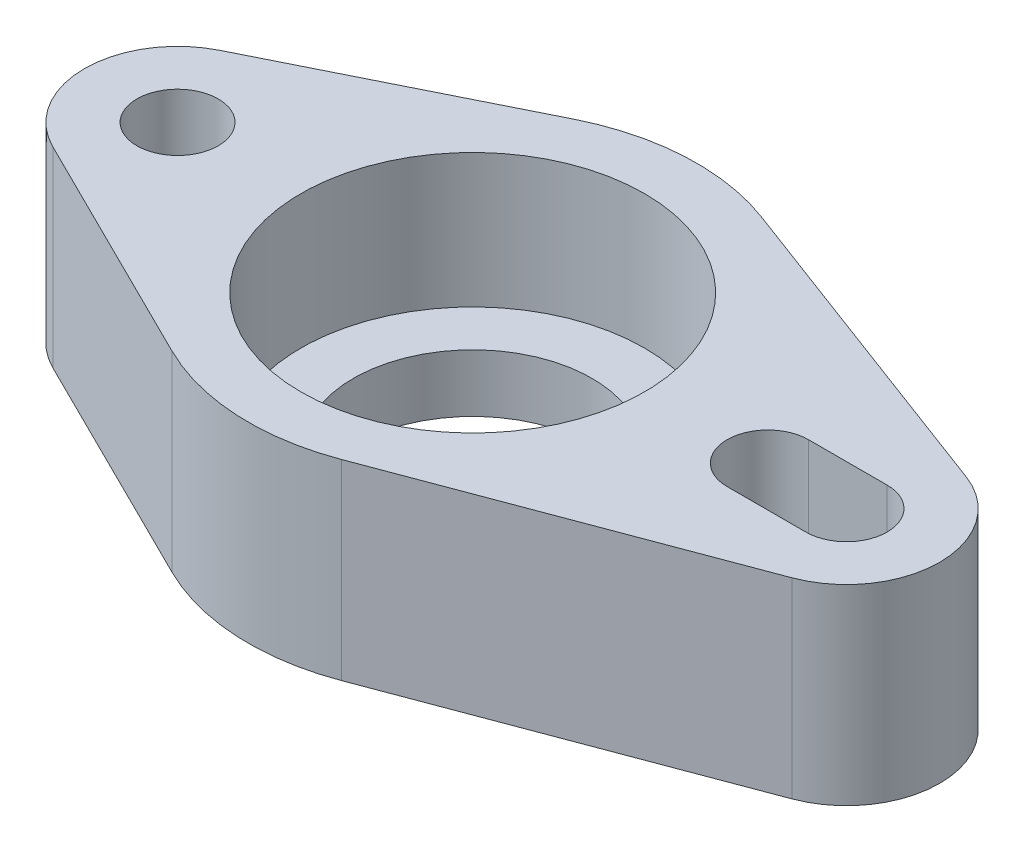
from build123d import *

# Parameters (mm, degrees)
SKETCH1_R     = 6.55
SKETCH1_R_2   = 1.55
BODY_DEPTH    = 7.3
SKETCH1_4_R   = 6.55
SKETCH1_4_R_2 = 4.55
FLOOR_2_DEPTH = 2.2


with BuildPart() as part:
    # Sketch1 → Body (new body)
    with BuildSketch(Plane(origin=(0, 0, 0), x_dir=(1, 0, 0), z_dir=(0, 1, 0))):
        with BuildLine():
            ThreePointArc((15.495614035, -3.324296268), (17.8, 0), (15.495614035, 3.324296268))
            Line((15.495614035, 3.324296268), (3, 8.006403687))
            ThreePointArc((3, 8.006403687), (-0.436058681, 8.538873042), (-3.8, 7.659144861))
            Line((-3.8, 7.659144861), (-12.827777778, 3.180112778))
            ThreePointArc((-12.827777778, 3.180112778), (-14.8, 0), (-12.827777778, -3.180112778))
            Line((-12.827777778, -3.180112778), (-3.8, -7.659144861))
            ThreePointArc((-3.8, -7.659144861), (-0.436058681, -8.538873042), (3, -8.006403687))
            Line((3, -8.006403687), (15.495614035, -3.324296268))
        make_face()
        with BuildLine():
            Line((11.25, 1.55), (14.25, 1.55))
            ThreePointArc((14.25, 1.55), (15.8, 0), (14.25, -1.55))
            Line((14.25, -1.55), (11.25, -1.55))
            ThreePointArc((11.25, -1.55), (9.7, 0), (11.25, 1.55))
        make_face(mode=Mode.SUBTRACT)
        Circle(SKETCH1_R, mode=Mode.SUBTRACT)
        with Locations((-11.25, 0)):
            Circle(SKETCH1_R_2, mode=Mode.SUBTRACT)
    extrude(amount=BODY_DEPTH)

    # Sketch1<4> → Floor 2 (add)
    with BuildSketch(Plane(origin=(0, 0, 0), x_dir=(1, 0, 0), z_dir=(0, 1, 0))):
        Circle(SKETCH1_4_R)
        Circle(SKETCH1_4_R_2, mode=Mode.SUBTRACT)
    extrude(amount=FLOOR_2_DEPTH)


solid = part.part
